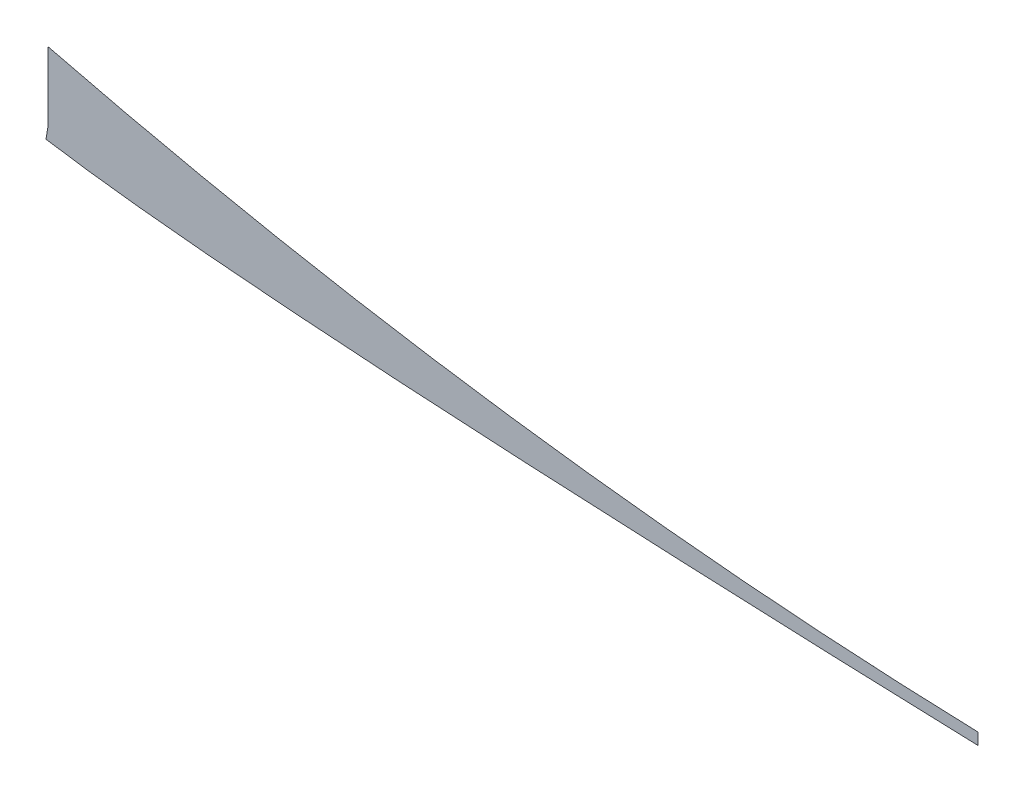
from build123d import *

# Parameters (mm, degrees)
BOSS_EXTRUDE1_DEPTH = 0.0001778


with BuildPart() as part:
    # Sketch1 → Boss-Extrude1 (new body)
    with BuildSketch(Plane.XY):
        with BuildLine():
            ThreePointArc((-508.024401726, -114.544046157), (-1515.418826993, -29.738179622), (-2508.024401726, 162.016184251))
            Line((-2508.024401726, 162.016184251), (-2508.024401726, 12.016184251))
            add(Edge.make_bspline(
                [(-508.024401726, -114.544046157), (-533.365550881, -113.769329009), (-608.544555847, -111.381889422), (-735.605527533, -106.939667032), (-865.564761, -101.937822414), (-958.768657742, -98.151766972), (-1012.774918748, -95.909487536), (-1094.326010114, -92.474741575), (-1217.952390669, -87.079235245), (-1383.807646154, -79.293536673), (-1548.760756574, -70.853344494), (-1764.88706881, -58.642627354), (-1971.322893498, -44.869434749), (-2254.31940598, -21.490500859), (-2413.84111278, -3.323156895), (-2508.024401726, 12.016184251)],
                knots=[0.324544959, 0.324544959, 0.324544959, 0.324544959, 0.340562491, 0.371812491, 0.403062491, 0.418687491, 0.426499991, 0.434312491, 0.465562491, 0.496812491, 0.528062491, 0.559312491, 0.621812491, 0.653062491, 0.746812491, 0.746812491, 0.746812491, 0.746812491], degree=3))
        make_face()
        with BuildLine():
            add(Edge.make_bspline(
                [(-508.024401726, -114.544046157), (-533.365550881, -113.769329009), (-608.544555847, -111.381889422), (-735.605527533, -106.939667032), (-865.564761, -101.937822414), (-958.768657742, -98.151766972), (-1012.774918748, -95.909487536), (-1094.326010114, -92.474741575), (-1217.952390669, -87.079235245), (-1383.807646154, -79.293536673), (-1548.760756574, -70.853344494), (-1764.88706881, -58.642627354), (-1971.322893498, -44.869434749), (-2254.31940598, -21.490500859), (-2413.84111278, -3.323156895), (-2508.024401726, 12.016184251)],
                knots=[0.324544959, 0.324544959, 0.324544959, 0.324544959, 0.340562491, 0.371812491, 0.403062491, 0.418687491, 0.426499991, 0.434312491, 0.465562491, 0.496812491, 0.528062491, 0.559312491, 0.621812491, 0.653062491, 0.746812491, 0.746812491, 0.746812491, 0.746812491], degree=3))
            Line((-2508.024401726, 12.016184251), (-2512.043123723, -12.658699204))
            add(Edge.make_bspline(
                [(-2512.043123723, -12.658699204), (-2510.054516109, -12.982577579), (-2506.091386595, -13.622923371), (-2498.042759678, -14.903219145), (-2487.836149169, -16.489493186), (-2475.332437705, -18.374960113), (-2458.333631626, -20.863671926), (-2436.476202003, -23.928516792), (-2409.302935957, -27.534170731), (-2381.214018357, -31.069270133), (-2342.580611439, -35.690527324), (-2292.147579141, -41.297541749), (-2228.44208922, -47.764331788), (-2161.793566025, -53.978340482), (-2092.446728836, -59.947910487), (-1996.719198485, -67.592672856), (-1871.563093469, -76.579315743), (-1714.568596677, -86.517592644), (-1552.761618525, -95.674011047), (-1388.107475048, -104.112588093), (-1250.138794963, -110.59947135), (-1140.260747115, -115.493320111), (-1058.325619128, -119.02447596), (-977.053458684, -122.426989504), (-897.242215664, -125.674158083), (-818.712690962, -128.759488748), (-715.554683808, -132.650116292), (-612.026651647, -136.281231976), (-535.130570095, -138.727693866), (-508.024401726, -139.555720716)],
                knots=[0.255847657, 0.255847657, 0.255847657, 0.255847657, 0.257796247, 0.259744837, 0.263642018, 0.267539199, 0.271436379, 0.27923074, 0.287025101, 0.294819463, 0.302613824, 0.318202546, 0.333791268, 0.349379991, 0.364968713, 0.380557435, 0.41173488, 0.442912324, 0.474089769, 0.505267213, 0.536444658, 0.55203338, 0.567622103, 0.583210825, 0.598799547, 0.614388269, 0.629976992, 0.661154436, 0.678276023, 0.678276023, 0.678276023, 0.678276023], degree=3))
            Line((-508.024401726, -139.555720716), (-508.024401726, -114.544046157))
        make_face()
    extrude(amount=BOSS_EXTRUDE1_DEPTH)


solid = part.part
